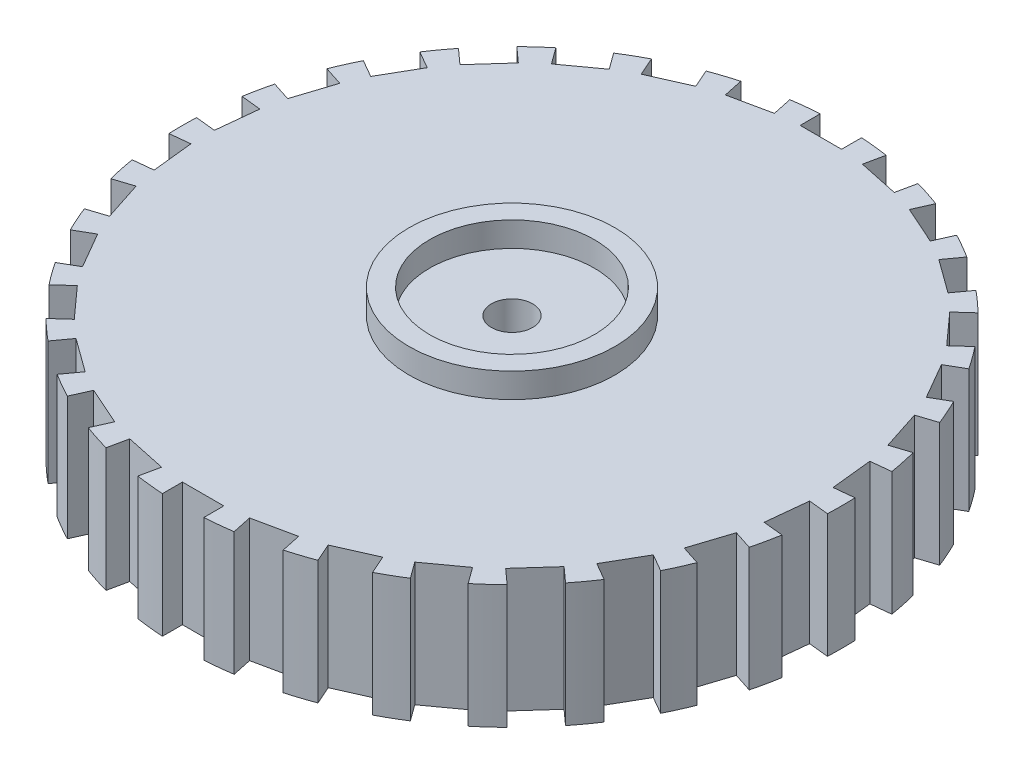
from build123d import *

# Parameters (mm, degrees)
CROQUIS1_R                   = 40
SALIENTE_EXTRUIR1_DEPTH      = 15
CORTAR_EXTRUIR1_START        = -16
CROQUIS2_W                   = 5.020915278
CROQUIS2_H                   = 5.016516428
CORTAR_EXTRUIR1_DEPTH        = 68
MATRIZC1_COUNT               = 30
SALIENTE_EXTRUIR2_DEPTH      = 18
SALIENTE_EXTRUIR2_DEPTH_BACK = 3
CROQUIS3_R                   = 12.5
CROQUIS3_R_2                 = 10
CORTAR_EXTRUIR2_DEPTH        = 60
CORTAR_EXTRUIR2_DEPTH_BACK   = 27
CROQUIS4_R                   = 2.5


with BuildPart() as part:
    # Croquis1 → Saliente-Extruir1 (new body)
    with BuildSketch(Plane(origin=(0, 0, 0), x_dir=(1, 0, 0), z_dir=(0, 1, 0))):
        with Locations(Location((0, 0, 0), (0, 0, 270))):
            Circle(CROQUIS1_R)
    extrude(amount=SALIENTE_EXTRUIR1_DEPTH)

    # Croquis2 → Cortar-Extruir1 (cut)
    with BuildSketch(Plane(origin=(0, 0, 0), x_dir=(1, 0, 0), z_dir=(0, 1, 0)).offset(CORTAR_EXTRUIR1_START)):
        with Locations((0, 40)):
            Rectangle(CROQUIS2_W, CROQUIS2_H)
    cortar_extruir1 = extrude(amount=CORTAR_EXTRUIR1_DEPTH, mode=Mode.SUBTRACT)

    # MatrizC1: Cortar-Extruir1 ×30 about axis
    matrizc1_axis = Axis((0, 0, 0), (0, 1, 0))
    for i in range(1, MATRIZC1_COUNT):
        add(cortar_extruir1.rotate(matrizc1_axis, i * 360 / MATRIZC1_COUNT), mode=Mode.SUBTRACT)

    # Croquis3 → Saliente-Extruir2 (add, two sides: drawn at the far end of the back side and taken through both)
    with BuildSketch(Plane(origin=(0, 0, 0), x_dir=(1, 0, 0), z_dir=(0, 1, 0)).offset(-SALIENTE_EXTRUIR2_DEPTH_BACK)):
        with Locations(Location((0, 0, 0), (0, 0, 270))):
            Circle(CROQUIS3_R)
        with Locations(Location((0, 0, 0), (0, 0, 270))):
            Circle(CROQUIS3_R_2, mode=Mode.SUBTRACT)
    extrude(amount=SALIENTE_EXTRUIR2_DEPTH + SALIENTE_EXTRUIR2_DEPTH_BACK)

    # Croquis4 → Cortar-Extruir2 (cut, two sides: drawn at the far end of the back side and taken through both)
    with BuildSketch(Plane(origin=(0, 0, 0), x_dir=(1, 0, 0), z_dir=(0, 1, 0)).offset(-CORTAR_EXTRUIR2_DEPTH_BACK)):
        with Locations(Location((0, 0, 0), (0, 0, 270))):
            Circle(CROQUIS4_R)
    extrude(amount=CORTAR_EXTRUIR2_DEPTH + CORTAR_EXTRUIR2_DEPTH_BACK, mode=Mode.SUBTRACT)


solid = part.part
